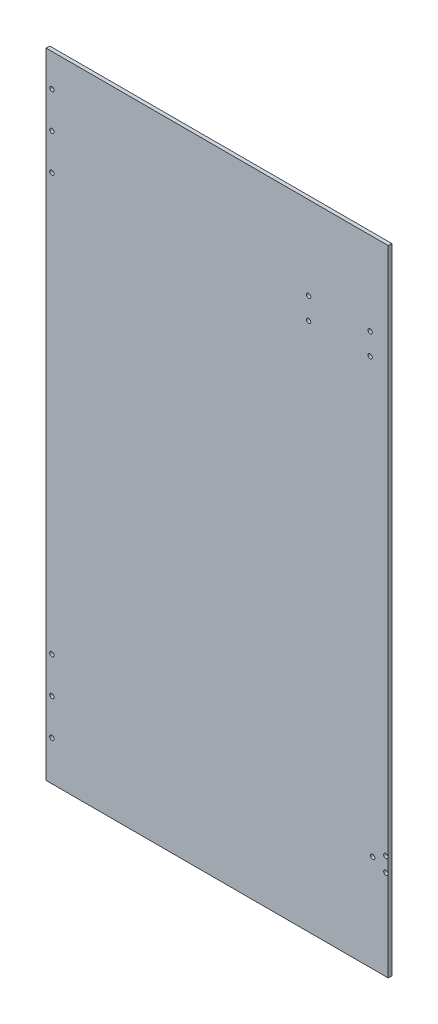
from build123d import *

# Parameters (mm, degrees)
SKETCH1_W           = 600.075
SKETCH1_H           = 1112.52
BOSS_EXTRUDE1_DEPTH = 6.35
SKETCH2_R           = 3.81
CUT_EXTRUDE1_DEPTH  = 1265.053431832


with BuildPart() as part:
    # Sketch1 → Boss-Extrude1 (new body)
    with BuildSketch(Plane.XY):
        with Locations((300.0375, -556.26)):
            Rectangle(SKETCH1_W, SKETCH1_H)
    extrude(amount=BOSS_EXTRUDE1_DEPTH)

    # Sketch2 → Cut-Extrude1 (cut, through all)
    with BuildSketch(Plane(origin=(0, 0, 0), x_dir=(-1, 0, 0), z_dir=(0, 0, -1))):
        with Locations((-10.1092, -57.15)):
            Circle(SKETCH2_R)
        with Locations((-10.1092, -120.65)):
            Circle(SKETCH2_R)
        with Locations((-10.1092, -184.15)):
            Circle(SKETCH2_R)
        with Locations((-10.1092, -915.67)):
            Circle(SKETCH2_R)
        with Locations((-10.1092, -979.17)):
            Circle(SKETCH2_R)
        with Locations((-10.1092, -1042.67)):
            Circle(SKETCH2_R)
        with Locations((-595.8205, -929.289000231)):
            Circle(SKETCH2_R)
        with Locations((-595.8205, -954.689000231)):
            Circle(SKETCH2_R)
        with Locations((-572.854666667, -941.989000231)):
            Circle(SKETCH2_R)
        with Locations((-568.325, -146.05)):
            Circle(SKETCH2_R)
        with Locations((-460.375, -146.05)):
            Circle(SKETCH2_R)
        with Locations((-460.375, -184.15)):
            Circle(SKETCH2_R)
        with Locations((-568.325, -184.15)):
            Circle(SKETCH2_R)
    extrude(amount=-CUT_EXTRUDE1_DEPTH, mode=Mode.SUBTRACT)


solid = part.part
